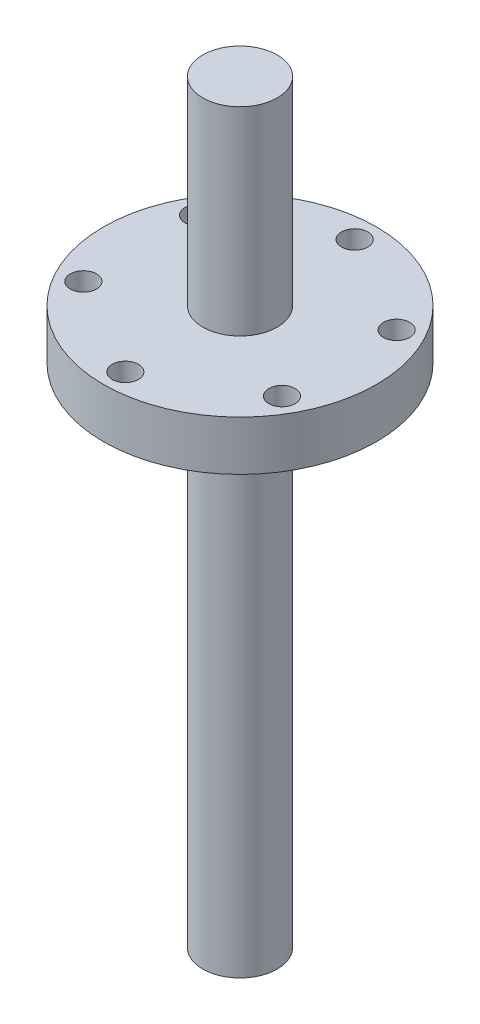
from build123d import *

# Parameters (mm, degrees)
SKETCH1_R          = 34.925
EXTRUDE1_DEPTH     = 12.7
SKETCH3_R          = 3.3655
CUT_EXTRUDE2_DEPTH = 12.7
CIRPATTERN1_COUNT  = 6
SKETCH5_R          = 9.525
EXTRUDE2_DEPTH     = 129.54
EXTRUDE3_START     = 50.8
SKETCH6_R          = 9.525
EXTRUDE3_DEPTH     = 50.8


with BuildPart() as part:
    # Sketch1 → Extrude1 (new body)
    with BuildSketch(Plane(origin=(0, 0, 0), x_dir=(1, 0, 0), z_dir=(0, 1, 0))):
        Circle(SKETCH1_R)
    extrude(amount=EXTRUDE1_DEPTH)

    # Sketch3 → Cut-Extrude2 (cut)
    with BuildSketch(Plane(origin=(0, 0, 0), x_dir=(1, 0, 0), z_dir=(0, 1, 0))):
        with Locations((0, 29.337)):
            Circle(SKETCH3_R)
    cut_extrude2 = extrude(amount=CUT_EXTRUDE2_DEPTH, mode=Mode.SUBTRACT)

    # CirPattern1: Cut-Extrude2 ×6 about axis
    cirpattern1_axis = Axis((0, 35.858162691, 0), (0, -1, 0))
    for i in range(1, CIRPATTERN1_COUNT):
        add(cut_extrude2.rotate(cirpattern1_axis, i * 360 / CIRPATTERN1_COUNT), mode=Mode.SUBTRACT)

    # Sketch5 → Extrude2 (add)
    with BuildSketch(Plane(origin=(0, 0, 0), x_dir=(1, 0, 0), z_dir=(0, 1, 0))):
        Circle(SKETCH5_R)
    extrude(amount=-EXTRUDE2_DEPTH)

    # Sketch6 → Extrude3 (add)
    with BuildSketch(Plane(origin=(0, 12.7, 0), x_dir=(-1, 0, 0), z_dir=(0, 1, 0)).offset(EXTRUDE3_START)):
        Circle(SKETCH6_R)
    extrude(amount=-EXTRUDE3_DEPTH)


solid = part.part
